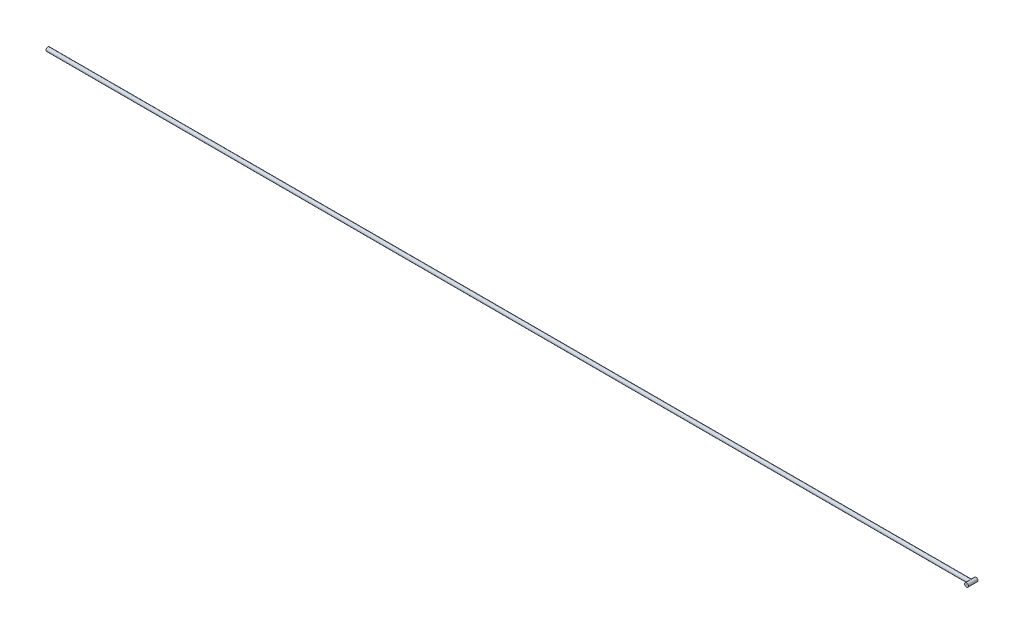
from build123d import *

# Parameters (mm, degrees)
BALAYAGE1_PROFILE_R = 1
BALAYAGE2_PROFILE_R = 1


with BuildPart() as part:
    # Balayage1: sweep along a path in Esquisse1
    with BuildLine(Plane.XY) as balayage1_path:
        Line((-240, 0), (240, 0))
    # Balayage1 profile (on start of the path) → Balayage1 (sweep)
    with BuildSketch(Plane(origin=(-240, 0, 0), x_dir=(0, 0, 1), z_dir=(1, 0, 0))):
        Circle(BALAYAGE1_PROFILE_R)
    sweep(path=balayage1_path.line)

    # Balayage2: sweep along a path in Esquisse16
    with BuildLine(Plane(origin=(240, 0, 0), x_dir=(0, 0, -1), z_dir=(1, 0, 0))) as balayage2_path:
        Line((-2.5, 0), (2.5, 0))
    # Balayage2 profile (on start of the path) → Balayage2 (sweep)
    with BuildSketch(Plane(origin=(240, 0, 2.5), x_dir=(-1, 0, 0), z_dir=(0, 0, -1))):
        Circle(BALAYAGE2_PROFILE_R)
    sweep(path=balayage2_path.line)


solid = part.part
